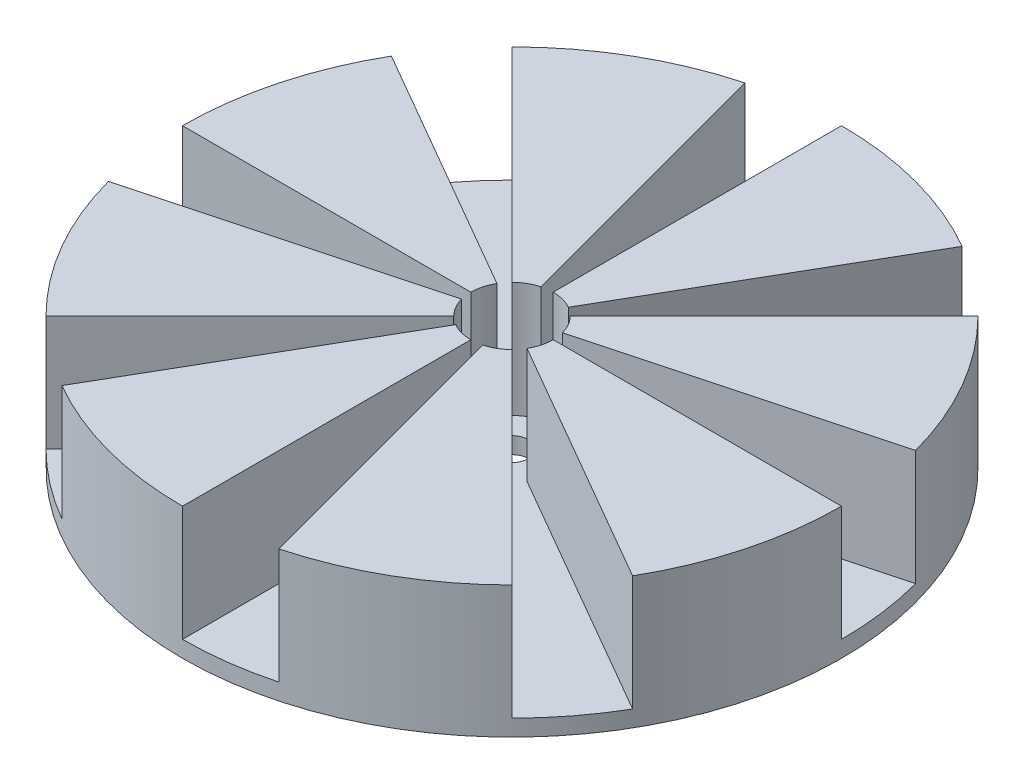
from build123d import *
from build123d.topology import SkipClean

# Parameters (mm, degrees)
SKETCH1_R                             = 20
FIRST_EXTRUDE_FOR_RUBBER_PIECE_DEPTH  = 1
SECOND_EXTRUDE_FOR_RUBBER_PIECE_DEPTH = 7
HOLE_FOR_SCREW_RUBBER_DEPTH           = 23
HOLE_FOR_SCREW_RUBBER_DEPTH_BACK      = 15
SKETCH3_R                             = 1


with BuildPart() as part:
    # Sketch1 → First Extrude for Rubber Piece (new body)
    with BuildSketch(Plane(origin=(0, 0, 0), x_dir=(1, 0, 0), z_dir=(0, 1, 0))):
        Circle(SKETCH1_R)
    extrude(amount=FIRST_EXTRUDE_FOR_RUBBER_PIECE_DEPTH)

    # Sketch2 → Second Extrude for Rubber Piece (add)
    with SkipClean():  # the faces are left unmerged after this step: merging them gives an invalid solid
        with BuildSketch(Plane(origin=(0, 1, 0), x_dir=(1, 0, 0), z_dir=(0, 1, 0))):
            with BuildLine():
                Line((0, 20), (0, 2.5))
                ThreePointArc((0, 2.5), (0.647047613, 2.414814566), (1.25, 2.165063509))
                Line((1.25, 2.165063509), (10, 17.320508076))
                ThreePointArc((10, 17.320508076), (5.176380902, 19.318516526), (0, 20))
            make_face()
            with BuildLine():
                ThreePointArc((-1.767766953, 1.767766953), (-1.25, 2.165063509), (-0.647047613, 2.414814566))
                Line((-0.647047613, 2.414814566), (-5.176380902, 19.318516526))
                ThreePointArc((-5.176380902, 19.318516526), (-10, 17.320508076), (-14.142135624, 14.142135624))
                Line((-14.142135624, 14.142135624), (-1.767766953, 1.767766953))
            make_face()
            with BuildLine():
                Line((14.142135624, 14.142135624), (1.767766953, 1.767766953))
                ThreePointArc((1.767766953, 1.767766953), (2.165063509, 1.25), (2.414814566, 0.647047613))
                Line((2.414814566, 0.647047613), (19.318516526, 5.176380902))
                ThreePointArc((19.318516526, 5.176380902), (17.320508076, 10), (14.142135624, 14.142135624))
            make_face()
            with BuildLine():
                ThreePointArc((-2.5, 0), (-2.414814566, 0.647047613), (-2.165063509, 1.25))
                Line((-2.165063509, 1.25), (-17.320508076, 10))
                ThreePointArc((-17.320508076, 10), (-19.318516526, 5.176380902), (-20, 0))
                Line((-20, 0), (-2.5, 0))
            make_face()
            with BuildLine():
                Line((20, 0), (2.5, 0))
                ThreePointArc((2.5, 0), (2.414814566, -0.647047613), (2.165063509, -1.25))
                Line((2.165063509, -1.25), (17.320508076, -10))
                ThreePointArc((17.320508076, -10), (19.318516526, -5.176380902), (20, 0))
            make_face()
            with BuildLine():
                ThreePointArc((-1.767766953, -1.767766953), (-2.165063509, -1.25), (-2.414814566, -0.647047613))
                Line((-2.414814566, -0.647047613), (-19.318516526, -5.176380902))
                ThreePointArc((-19.318516526, -5.176380902), (-17.320508076, -10), (-14.142135624, -14.142135624))
                Line((-14.142135624, -14.142135624), (-1.767766953, -1.767766953))
            make_face()
            with BuildLine():
                Line((14.142135624, -14.142135624), (1.767766953, -1.767766953))
                ThreePointArc((1.767766953, -1.767766953), (1.25, -2.165063509), (0.647047613, -2.414814566))
                Line((0.647047613, -2.414814566), (5.176380902, -19.318516526))
                ThreePointArc((5.176380902, -19.318516526), (10, -17.320508076), (14.142135624, -14.142135624))
            make_face()
            with BuildLine():
                ThreePointArc((0, -2.5), (-0.647047613, -2.414814566), (-1.25, -2.165063509))
                Line((-1.25, -2.165063509), (-10, -17.320508076))
                ThreePointArc((-10, -17.320508076), (-5.176380902, -19.318516526), (0, -20))
                Line((0, -20), (0, -2.5))
            make_face()
        extrude(amount=SECOND_EXTRUDE_FOR_RUBBER_PIECE_DEPTH)

    # Sketch3 → Hole for Screw (Rubber) (cut, two sides: drawn at the far end of the back side and taken through both)
    with SkipClean():  # the faces are left unmerged after this step: merging them gives an invalid solid
        with BuildSketch(Plane(origin=(0, 1, 0), x_dir=(1, 0, 0), z_dir=(0, 1, 0)).offset(-HOLE_FOR_SCREW_RUBBER_DEPTH_BACK)):
            Circle(SKETCH3_R)
        extrude(amount=HOLE_FOR_SCREW_RUBBER_DEPTH + HOLE_FOR_SCREW_RUBBER_DEPTH_BACK, mode=Mode.SUBTRACT)


solid = part.part
